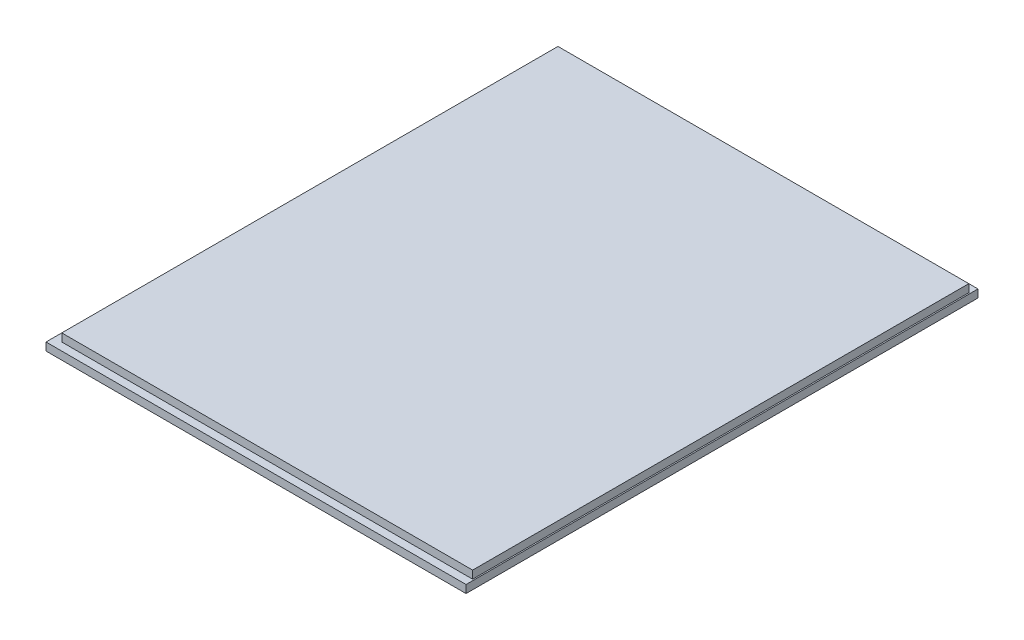
from build123d import *

# Parameters (mm, degrees)
SKETCH1_W           = 203.2
SKETCH1_H           = 247.65
BOSS_EXTRUDE1_DEPTH = 3.81
SKETCH2_W           = 198.755
SKETCH2_H           = 240.03
BOSS_EXTRUDE2_DEPTH = 3.81
SKETCH3_W           = 192.405
SKETCH3_H           = 240.03
SKETCH3_W_2         = 188.332936508
SKETCH3_H_2         = 234.95
BOSS_EXTRUDE3_DEPTH = 3.81
SKETCH4_R           = 30.1625
BOSS_EXTRUDE4_DEPTH = 3.81


with BuildPart() as part:
    # Sketch1 → Boss-Extrude1 (new body)
    with BuildSketch(Plane(origin=(0, 0, 0), x_dir=(1, 0, 0), z_dir=(0, 1, 0))):
        with Locations((-1.5875, 0)):
            Rectangle(SKETCH1_W, SKETCH1_H)
    extrude(amount=BOSS_EXTRUDE1_DEPTH)

    # Sketch2 → Boss-Extrude2 (add)
    with BuildSketch(Plane(origin=(0, 3.81, 0), x_dir=(1, 0, 0), z_dir=(0, 1, 0))):
        Rectangle(SKETCH2_W, SKETCH2_H)
    extrude(amount=BOSS_EXTRUDE2_DEPTH)

    # Sketch3 → Boss-Extrude3 (add)
    with BuildSketch(Plane.XZ):
        Rectangle(SKETCH3_W, SKETCH3_H)
        Rectangle(SKETCH3_W_2, SKETCH3_H_2, mode=Mode.SUBTRACT)
    extrude(amount=BOSS_EXTRUDE3_DEPTH)

    # Sketch4 → Boss-Extrude4 (add)
    with BuildSketch(Plane(origin=(0, 0, 0), x_dir=(-1, 0, 0), z_dir=(0, -1, 0))):
        with BuildLine():
            Line((-92.538814631, 117.475), (-19.447411716, 26.291665671))
            ThreePointArc((-19.447411716, 26.291665671), (0, 32.7025), (19.447411716, 26.291665671))
            Line((19.447411716, 26.291665671), (92.538814631, 117.475))
            Line((92.538814631, 117.475), (94.166468254, 117.475))
            Line((94.166468254, 117.475), (94.166468254, 115.444461816))
            Line((94.166468254, 115.444461816), (21.429283015, 24.703022805))
            ThreePointArc((21.429283015, 24.703022805), (32.7025, 0), (21.429283015, -24.703022805))
            Line((21.429283015, -24.703022805), (94.166468254, -115.444461816))
            Line((94.166468254, -115.444461816), (94.166468254, -117.475))
            Line((94.166468254, -117.475), (92.538814631, -117.475))
            Line((92.538814631, -117.475), (19.447411716, -26.291665671))
            ThreePointArc((19.447411716, -26.291665671), (0, -32.7025), (-19.447411716, -26.291665671))
            Line((-19.447411716, -26.291665671), (-92.538814631, -117.475))
            Line((-92.538814631, -117.475), (-94.166468254, -117.475))
            Line((-94.166468254, -117.475), (-94.166468254, -115.444461816))
            Line((-94.166468254, -115.444461816), (-21.429283015, -24.703022805))
            ThreePointArc((-21.429283015, -24.703022805), (-32.7025, 0), (-21.429283015, 24.703022805))
            Line((-21.429283015, 24.703022805), (-94.166468254, 115.444461816))
            Line((-94.166468254, 115.444461816), (-94.166468254, 117.475))
            Line((-94.166468254, 117.475), (-92.538814631, 117.475))
        make_face()
        with Locations(Location((0, 0, 0), (0, 0, 90))):
            Circle(SKETCH4_R, mode=Mode.SUBTRACT)
    extrude(amount=BOSS_EXTRUDE4_DEPTH)


solid = part.part
